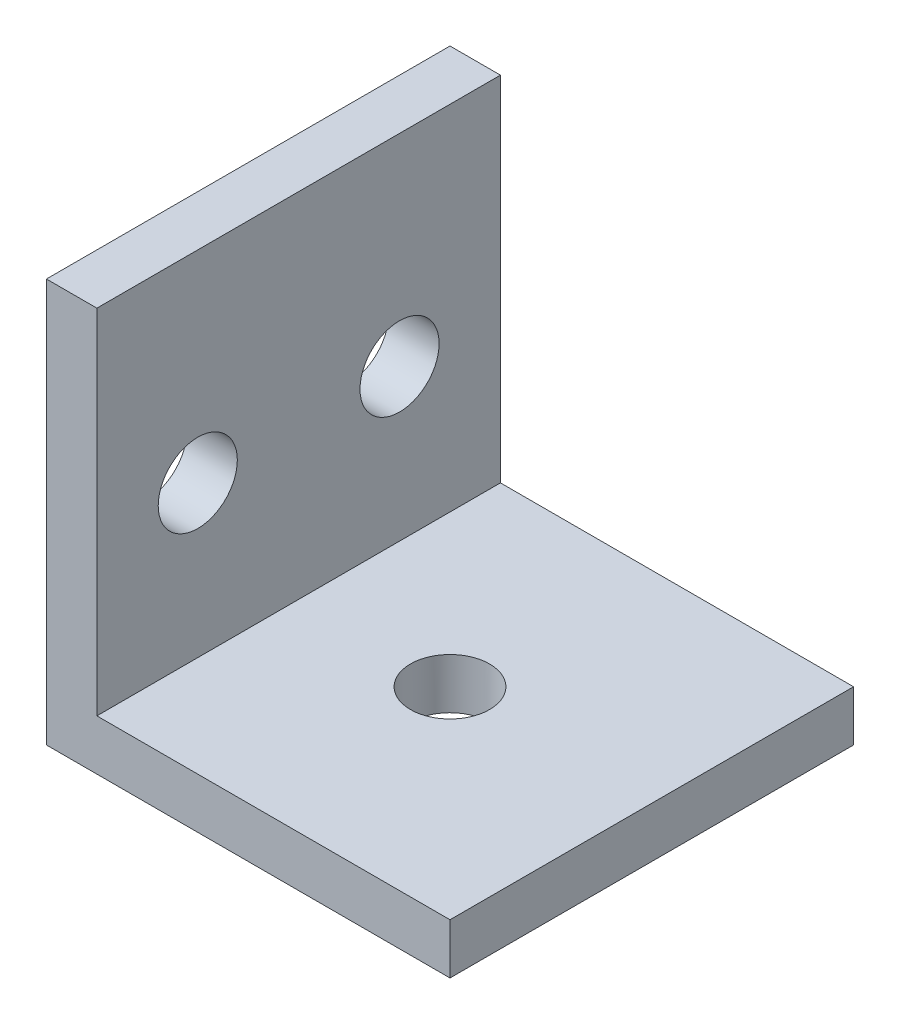
from build123d import *

# Parameters (mm, degrees)
BOSS_EXTRUDE1_DEPTH     = 12.7
CUT_EXTRUDE1_DEPTH      = 37.061067996
CUT_EXTRUDE1_DEPTH_BACK = 37.061067996
SKETCH3_R               = 2.4892
CUT_EXTRUDE2_DEPTH      = 37.061067996
CUT_EXTRUDE2_DEPTH_BACK = 37.061067996
SKETCH4_R               = 2.4892


with BuildPart() as part:
    # Sketch1 → Boss-Extrude1 (new, symmetric)
    with BuildSketch(Plane.XY):
        Polygon((0, 0), (0, 25.4), (3.175, 25.4), (3.175, 3.175), (25.4, 3.175), (25.4, 0), align=None)
    extrude(amount=BOSS_EXTRUDE1_DEPTH, both=True)

    # Sketch3 → Cut-Extrude1 (cut, two sides: drawn at the far end of the back side and taken through both)
    with BuildSketch(Plane(origin=(0, 3.175, 0), x_dir=(1, 0, 0), z_dir=(0, 1, 0)).offset(-CUT_EXTRUDE1_DEPTH_BACK)):
        with Locations(Location((12.7, 0, 0), (0, 0, 270))):
            Circle(SKETCH3_R)
    extrude(amount=CUT_EXTRUDE1_DEPTH + CUT_EXTRUDE1_DEPTH_BACK, mode=Mode.SUBTRACT)

    # Sketch4 → Cut-Extrude2 (cut, two sides: drawn at the far end of the back side and taken through both)
    with BuildSketch(Plane(origin=(3.175, 0, 0), x_dir=(0, 0, -1), z_dir=(1, 0, 0)).offset(-CUT_EXTRUDE2_DEPTH_BACK)):
        with Locations(Location((-6.35, 12.7, 0), (0, 0, 90))):
            Circle(SKETCH4_R)
        with Locations(Location((6.35, 12.7, 0), (0, 0, 90))):
            Circle(SKETCH4_R)
    extrude(amount=CUT_EXTRUDE2_DEPTH + CUT_EXTRUDE2_DEPTH_BACK, mode=Mode.SUBTRACT)


solid = part.part
